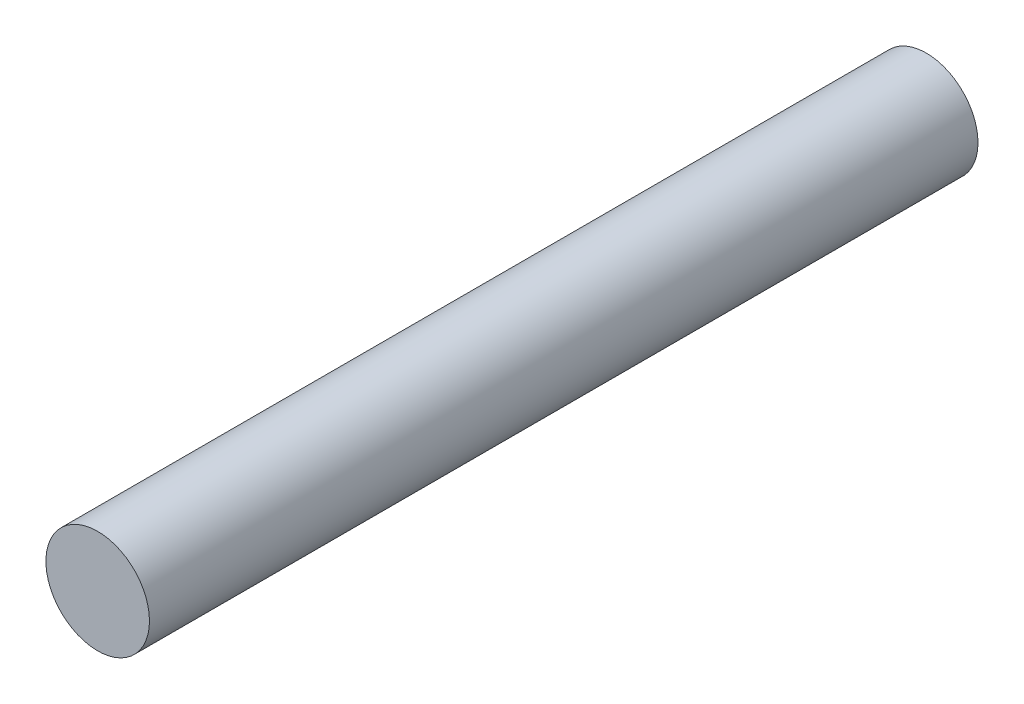
from build123d import *

# Parameters (mm, degrees)
SKETCH1_R           = 2.5
BOSS_EXTRUDE1_DEPTH = 40


with BuildPart() as part:
    # Sketch1 → Boss-Extrude1 (new body)
    with BuildSketch(Plane(origin=(0, 0, 0), x_dir=(0, 1, 0), z_dir=(0, 0, 1))):
        with Locations(Location((0, 0, 0), (0, 0, 270))):
            Circle(SKETCH1_R)
    extrude(amount=BOSS_EXTRUDE1_DEPTH)


solid = part.part
